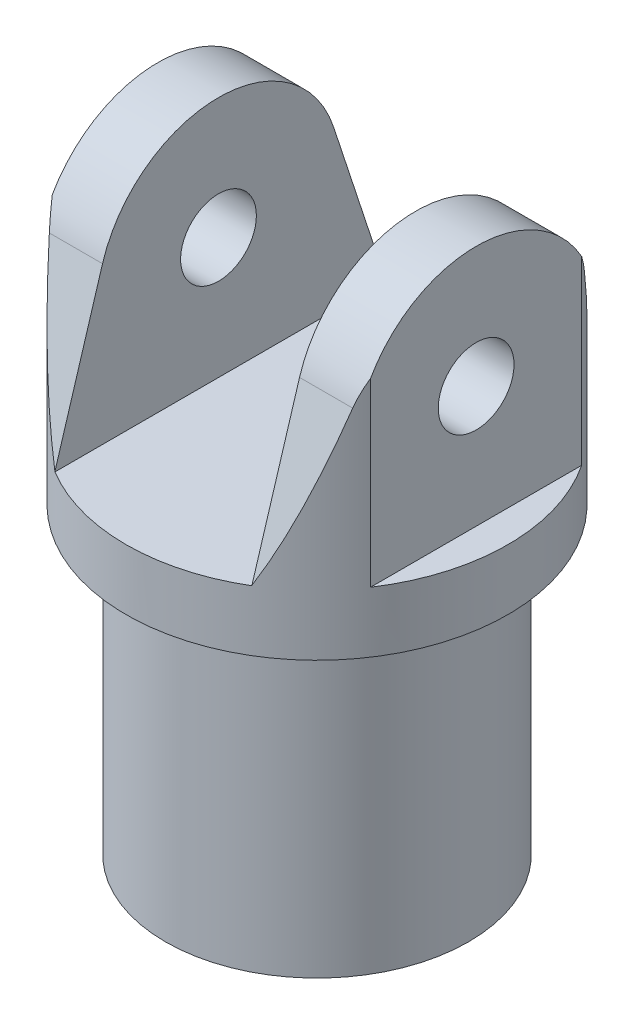
from build123d import *

# Parameters (mm, degrees)
SKETCH1_R               = 8.001
BOSS_EXTRUDE1_DEPTH     = 25.4
SKETCH2_R               = 8.001
SKETCH2_R_2             = 6.35
SKETCH2_R_3             = 4.699
CUT_EXTRUDE1_DEPTH      = 12.7
CUT_EXTRUDE2_DEPTH      = 28.806330251
CUT_EXTRUDE2_DEPTH_BACK = 28.806330251
SKETCH3_W               = 8.255
SKETCH3_H               = 10.16
SKETCH3_W_2             = 1.3335
CUT_EXTRUDE3_DEPTH      = 31.402975072


with BuildPart() as part:
    # Sketch1 → Boss-Extrude1 (new body)
    with BuildSketch(Plane(origin=(0, 0, 0), x_dir=(1, 0, 0), z_dir=(0, 1, 0))):
        with Locations(Location((0, 0, 0), (0, 0, 270))):
            Circle(SKETCH1_R)
    extrude(amount=BOSS_EXTRUDE1_DEPTH)

    # Sketch2 → Cut-Extrude1 (cut)
    # profile 1 of 2: a face of its own
    with BuildSketch(Plane(origin=(0, 0, 0), x_dir=(-1, 0, 0), z_dir=(0, -1, 0))):
        with Locations(Location((0, 0, 0), (0, 0, 90))):
            Circle(SKETCH2_R)
        with Locations(Location((0, 0, 0), (0, 0, 90))):
            Circle(SKETCH2_R_2, mode=Mode.SUBTRACT)
    # profile 2 of 2: a face of its own
    with BuildSketch(Plane(origin=(0, 0, 0), x_dir=(-1, 0, 0), z_dir=(0, -1, 0))):
        with Locations(Location((0, 0, 0), (0, 0, 90))):
            Circle(SKETCH2_R_3)
    extrude(amount=-CUT_EXTRUDE1_DEPTH, mode=Mode.SUBTRACT)

    # Sketch3 → Cut-Extrude2 (cut, two sides: drawn at the far end of the back side and taken through both)
    with BuildSketch(Plane.XY.offset(-CUT_EXTRUDE2_DEPTH_BACK)):
        with Locations((0, 20.32)):
            Rectangle(SKETCH3_W, SKETCH3_H)
        with Locations((-7.33425, 20.32)):
            Rectangle(SKETCH3_W_2, SKETCH3_H)
        with Locations((7.33425, 20.32)):
            Rectangle(SKETCH3_W_2, SKETCH3_H)
    extrude(amount=CUT_EXTRUDE2_DEPTH + CUT_EXTRUDE2_DEPTH_BACK, mode=Mode.SUBTRACT)

    # Sketch4 → Cut-Extrude3 (cut, through all)
    with BuildSketch(Plane(origin=(6.6675, 0, 0), x_dir=(0, 0, -1), z_dir=(1, 0, 0))):
        with BuildLine():
            Line((-4.422719158, 25.4), (0, 25.4))
            Line((0, 25.4), (4.422719158, 25.4))
            Line((4.422719158, 25.4), (4.422719158, 22.819190919))
            ThreePointArc((4.422719158, 22.819190919), (4.646674927, 22.373000761), (4.825752455, 21.906982432))
            Line((4.825752455, 21.906982432), (7.018236237, 15.24))
            Line((7.018236237, 15.24), (6.955993892, 50.8))
            Line((6.955993892, 50.8), (-6.858660717, 50.8))
            Line((-6.858660717, 50.8), (-6.858660717, 15.24))
            Line((-6.858660717, 15.24), (-4.859385257, 21.800802121))
            ThreePointArc((-4.859385257, 21.800802121), (-4.668901855, 22.321937928), (-4.422719158, 22.819190919))
            Line((-4.422719158, 22.819190919), (-4.422719158, 25.4))
        make_face()
        with BuildLine():
            ThreePointArc((1.5875, 20.32), (1.122532015, 21.442532015), (0, 21.9075))
            Line((0, 21.9075), (0, 18.7325))
            ThreePointArc((0, 18.7325), (1.122532015, 19.197467985), (1.5875, 20.32))
        make_face()
        with BuildLine():
            Line((0, 18.7325), (0, 21.9075))
            ThreePointArc((0, 21.9075), (-1.5875, 20.32), (0, 18.7325))
        make_face()
        with BuildLine():
            ThreePointArc((-4.422719158, 22.819190919), (-2.560323235, 24.707612669), (0, 25.4))
            Line((0, 25.4), (-4.422719158, 25.4))
            Line((-4.422719158, 25.4), (-4.422719158, 22.819190919))
        make_face()
        with BuildLine():
            Line((4.422719158, 25.4), (0, 25.4))
            ThreePointArc((0, 25.4), (2.560323235, 24.707612669), (4.422719158, 22.819190919))
            Line((4.422719158, 22.819190919), (4.422719158, 25.4))
        make_face()
    extrude(amount=-CUT_EXTRUDE3_DEPTH, mode=Mode.SUBTRACT)


solid = part.part
